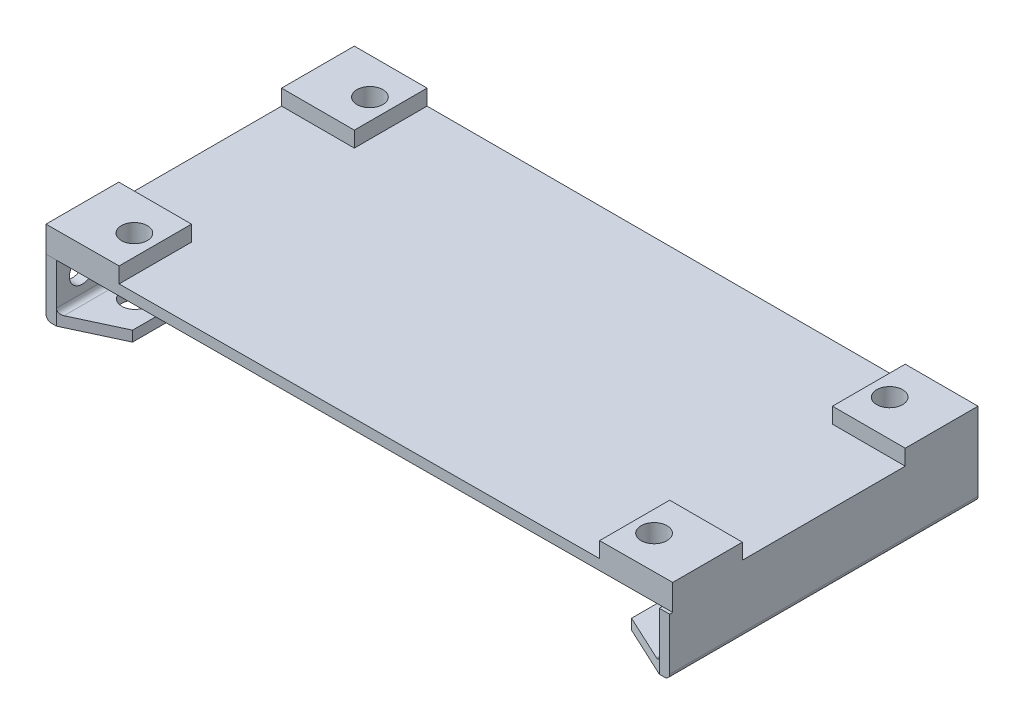
from build123d import *

# Parameters (mm, degrees)
BOSS_EXTRUDE1_DEPTH = 2
SKETCH2_W           = 59.326153163
SKETCH2_H           = 11
BOSS_EXTRUDE2_DEPTH = 2
FILLET1_R           = 1
SKETCH3_R           = 2.5
BOSS_EXTRUDE3_DEPTH = 2
FILLET3_R           = 1
SKETCH4_R           = 2.5
CUT_EXTRUDE1_DEPTH  = 2
BOSS_EXTRUDE5_START = 2
SKETCH3_5_W         = 14
SKETCH3_5_H         = 14
SKETCH3_5_R         = 2.5
BOSS_EXTRUDE5_DEPTH = 3
SKETCH5_R           = 2.5
CUT_EXTRUDE2_DEPTH  = 2


with BuildPart() as part:
    # Sketch1 → Boss-Extrude1 (new body)
    with BuildSketch(Plane(origin=(0, 0, 0), x_dir=(1, 0, 0), z_dir=(0, 1, 0))):
        Polygon((-49.061898328, -3.336557388), (-49.061898328, -53.336557388), (-59.061898328, -57.999633969), (-59.061898328, 1.326519194), align=None)
    boss_extrude1 = extrude(amount=BOSS_EXTRUDE1_DEPTH)

    # Sketch2 → Boss-Extrude2 (add)
    with BuildSketch(Plane.ZY.offset(59.061898328)):
        with Locations((28.336557388, 5.5)):
            Rectangle(SKETCH2_W, SKETCH2_H)
    boss_extrude2 = extrude(amount=BOSS_EXTRUDE2_DEPTH)

    # Fillet1
    fillet1_edges = [part.edges().sort_by_distance(p)[0] for p in [
        (-61.061898328, 0, 28.336557388),
        (-59.061898328, 2, 28.336557388),
    ]]
    fillet(fillet1_edges, radius=FILLET1_R)

    # Sketch3 → Boss-Extrude3 (add)
    with BuildSketch(Plane(origin=(0, 11, 0), x_dir=(1, 0, 0), z_dir=(0, 1, 0))):
        Polygon((-61.061898328, 1.326519194), (-61.061898328, -57.999633969), (58.938101672, -57.413440129), (58.938101672, 1.326519194), align=None)
        with Locations(Location((-51.061898328, -5.673480806, 0), (0, 0, 270))):
            Circle(SKETCH3_R, mode=Mode.SUBTRACT)
        with Locations(Location((48.938101672, -5.673480806, 0), (0, 0, 270))):
            Circle(SKETCH3_R, mode=Mode.SUBTRACT)
        with Locations(Location((-51.061898328, -50.999633969, 0), (0, 0, 270))):
            Circle(SKETCH3_R, mode=Mode.SUBTRACT)
        with Locations(Location((48.938101672, -50.999633969, 0), (0, 0, 270))):
            Circle(SKETCH3_R, mode=Mode.SUBTRACT)
    extrude(amount=BOSS_EXTRUDE3_DEPTH)

    # Mirror1: Boss-Extrude2 across plane
    add(boss_extrude2.mirror(Plane.ZY.offset(1.061898328)))

    # Mirror2: Boss-Extrude1 across plane
    add(boss_extrude1.mirror(Plane.ZY.offset(1.061898328)))

    # Fillet3
    fillet3_edges = [part.edges().sort_by_distance(p)[0] for p in [
        (58.938101672, 0, 28.336557388),
        (56.938101672, 2, 28.336557388),
    ]]
    fillet(fillet3_edges, radius=FILLET3_R)

    # Sketch4 → Cut-Extrude1 (cut)
    with BuildSketch(Plane.ZY.offset(61.061898328)):
        with Locations((3.673480806, 7)):
            Circle(SKETCH4_R)
        with Locations(Location((52.999633969, 7, 0), (0, 0, 180))):
            Circle(SKETCH4_R)
    extrude(amount=-CUT_EXTRUDE1_DEPTH, mode=Mode.SUBTRACT)

    # Sketch3<5> → Boss-Extrude5 (add)
    # profile 1 of 4: a face of its own
    with BuildSketch(Plane(origin=(0, 11, 0), x_dir=(1, 0, 0), z_dir=(0, 1, 0)).offset(BOSS_EXTRUDE5_START)):
        with Locations((-54.061898328, -5.673480806)):
            Rectangle(SKETCH3_5_W, SKETCH3_5_H)
        with Locations(Location((-51.061898328, -5.673480806, 0), (0, 0, 270))):
            Circle(SKETCH3_5_R, mode=Mode.SUBTRACT)
    # profile 2 of 4: a face of its own
    with BuildSketch(Plane(origin=(0, 11, 0), x_dir=(1, 0, 0), z_dir=(0, 1, 0)).offset(BOSS_EXTRUDE5_START)):
        with Locations((51.938101672, -5.673480806)):
            Rectangle(SKETCH3_5_W, SKETCH3_5_H)
        with Locations(Location((48.938101672, -5.673480806, 0), (0, 0, 270))):
            Circle(SKETCH3_5_R, mode=Mode.SUBTRACT)
    # profile 3 of 4: a face of its own
    with BuildSketch(Plane(origin=(0, 11, 0), x_dir=(1, 0, 0), z_dir=(0, 1, 0)).offset(BOSS_EXTRUDE5_START)):
        Polygon((-47.061898328, -43.999633969), (-61.061898328, -43.999633969), (-61.061898328, -57.999633969), (-47.061898328, -57.931244688), align=None)
        with Locations(Location((-51.061898328, -50.999633969, 0), (0, 0, 270))):
            Circle(SKETCH3_5_R, mode=Mode.SUBTRACT)
    # profile 4 of 4: a face of its own
    with BuildSketch(Plane(origin=(0, 11, 0), x_dir=(1, 0, 0), z_dir=(0, 1, 0)).offset(BOSS_EXTRUDE5_START)):
        Polygon((58.938101672, -57.413440129), (58.938101672, -43.999633969), (44.938101672, -43.999633969), (44.938101672, -57.481829411), align=None)
        with Locations(Location((48.938101672, -50.999633969, 0), (0, 0, 270))):
            Circle(SKETCH3_5_R, mode=Mode.SUBTRACT)
    extrude(amount=BOSS_EXTRUDE5_DEPTH)

    # Sketch5 → Cut-Extrude2 (cut)
    with BuildSketch(Plane.XZ):
        with Locations(Location((-54.061898328, 47.903918034, 0), (0, 0, 270))):
            Circle(SKETCH5_R)
        with Locations(Location((51.938101672, 47.903918034, 0), (0, 0, 270))):
            Circle(SKETCH5_R)
        with Locations(Location((51.938101672, 8.769196741, 0), (0, 0, 270))):
            Circle(SKETCH5_R)
        with Locations(Location((-54.061898328, 8.769196741, 0), (0, 0, 270))):
            Circle(SKETCH5_R)
    extrude(amount=-CUT_EXTRUDE2_DEPTH, mode=Mode.SUBTRACT)


solid = part.part
